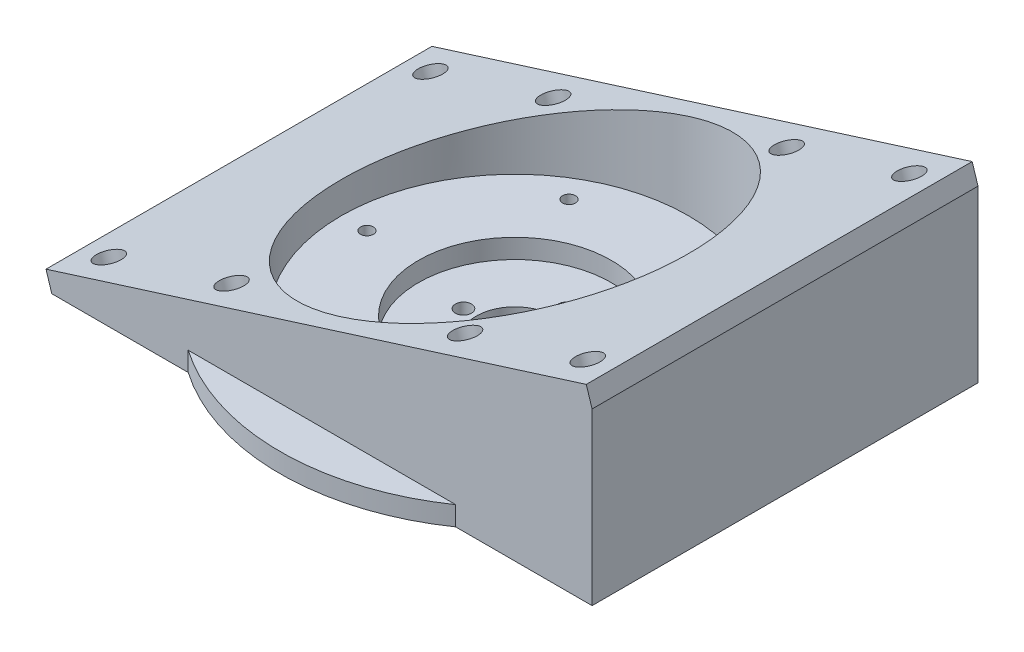
from build123d import *

# Parameters (mm, degrees)
EXTRUDE_1_DEPTH          = 60
SKETCH_2_W               = 88.076446511
SKETCH_2_H               = 60
EXTRUDE_2_DEPTH          = 3
SKETCH_3_R               = 27
CUT_EXTRUDE_1_DEPTH      = 50
SKETCH_4_R               = 36.5
EXTRUDE_3_DEPTH          = 3
SKETCH_13_R              = 20
CUT_EXTRUDE_3_DEPTH      = 60
SKETCH_14_R              = 1
CUT_EXTRUDE_4_DEPTH      = 60
PATTERN_CIRCULAR_1_COUNT = 6
SKETCH_16_R              = 2
CUT_EXTRUDE_5_DEPTH      = 3
PATTERN_LINEAR_1_COUNT   = 2
PATTERN_LINEAR_1_PITCH   = 20
SKETCH_17_R              = 2
CUT_EXTRUDE_6_DEPTH      = 3
PATTERN_LINEAR_2_COUNT   = 2
PATTERN_LINEAR_2_PITCH   = 20
SKETCH_18_R              = 20
EXTRUDE_4_DEPTH          = 6
SKETCH_19_R              = 6
CUT_EXTRUDE_7_DEPTH      = 6
SKETCH_20_R              = 15
CUT_EXTRUDE_8_DEPTH      = 3
SKETCH_21_R              = 1.25
CUT_EXTRUDE_9_DEPTH      = 3
PATTERN_CIRCULAR_2_COUNT = 4


with BuildPart() as part:
    # 草图1 → 凸台-拉伸1 (new body)
    with BuildSketch(Plane.XY):
        Polygon((-67.082379863, -7.957665904), (16.917620137, -7.957665904), (16.917620137, 18.527432362), align=None)
    extrude(amount=EXTRUDE_1_DEPTH)

    # 草图2 → 凸台-拉伸2 (add)
    with BuildSketch(Plane(origin=(-3.783690806, 12.000334093, 0), x_dir=(0.9537169507482267, 0.30070579950427384, 0), z_dir=(-0.30070579950427384, 0.9537169507482267, 0))):
        with Locations((-22.332295804, -30)):
            Rectangle(SKETCH_2_W, SKETCH_2_H)
    extrude(amount=EXTRUDE_2_DEPTH)

    # 草图3 → 切除-拉伸1 (cut)
    with BuildSketch(Plane(origin=(0, -7.957665904, 0), x_dir=(-1, 0, 0), z_dir=(0, -1, 0))):
        with Locations(Location((25.082379863, -30, 0), (0, 0, 90))):
            Circle(SKETCH_3_R)
    extrude(amount=-CUT_EXTRUDE_1_DEPTH, mode=Mode.SUBTRACT)

    # 草图4 → 凸台-拉伸3 (add)
    with BuildSketch(Plane(origin=(0, -7.957665904, 0), x_dir=(-1, 0, 0), z_dir=(0, -1, 0))):
        with Locations((25.082379863, -30)):
            Circle(SKETCH_4_R)
    extrude(amount=-EXTRUDE_3_DEPTH)

    # 草图13 → 切除-拉伸3 (cut)
    with BuildSketch(Plane(origin=(0, -4.957665904, 0), x_dir=(1, 0, 0), z_dir=(0, 1, 0))):
        with Locations(Location((-25.082379863, -30, 0), (0, 0, 270))):
            Circle(SKETCH_13_R)
    extrude(amount=-CUT_EXTRUDE_3_DEPTH, mode=Mode.SUBTRACT)

    # 草图14 → 切除-拉伸4 (cut)
    with BuildSketch(Plane(origin=(0, -4.957665904, 0), x_dir=(1, 0, 0), z_dir=(0, 1, 0))):
        with Locations(Location((-48.082379863, -30, 0), (0, 0, 270))):
            Circle(SKETCH_14_R)
    cut_extrude_4 = extrude(amount=-CUT_EXTRUDE_4_DEPTH, mode=Mode.SUBTRACT)

    # 阵列(圆周)1: 切除-拉伸4 ×6 about axis
    pattern_circular_1_axis = Axis((-25.082379863, 0, 30), (0, 1, 0))
    for i in range(1, PATTERN_CIRCULAR_1_COUNT):
        add(cut_extrude_4.rotate(pattern_circular_1_axis, i * 360 / PATTERN_CIRCULAR_1_COUNT), mode=Mode.SUBTRACT)

    # 草图16 → 切除-拉伸5 (cut)
    with BuildSketch(Plane(origin=(-4.685808204, 14.861484946, 0), x_dir=(0.9537169507482267, 0.3007057995042738, 0), z_dir=(-0.3007057995042738, 0.9537169507482267, 0))):
        with Locations(Location((-61.370519059, -5, 0), (0, 0, 180))):
            Circle(SKETCH_16_R)
        with Locations(Location((-61.370519059, -55, 0), (0, 0, 180))):
            Circle(SKETCH_16_R)
    cut_extrude_5 = extrude(amount=-CUT_EXTRUDE_5_DEPTH, mode=Mode.SUBTRACT)

    # 阵列(线性)1: 切除-拉伸5 ×2
    with Locations(*[Vector(0.9537169507482268, 0.30070579950427384, 0) * (i * PATTERN_LINEAR_1_PITCH) for i in range(1, PATTERN_LINEAR_1_COUNT)]):
        add(cut_extrude_5, mode=Mode.SUBTRACT)

    # 草图17 → 切除-拉伸6 (cut)
    with BuildSketch(Plane(origin=(-4.685808204, 14.861484946, 0), x_dir=(0.9537169507482267, 0.3007057995042738, 0), z_dir=(-0.3007057995042738, 0.9537169507482267, 0))):
        with Locations(Location((16.705927452, -55, 0), (0, 0, 180))):
            Circle(SKETCH_17_R)
        with Locations(Location((16.705927452, -5, 0), (0, 0, 180))):
            Circle(SKETCH_17_R)
    cut_extrude_6 = extrude(amount=-CUT_EXTRUDE_6_DEPTH, mode=Mode.SUBTRACT)

    # 阵列(线性)2: 切除-拉伸6 ×2
    with Locations(*[Vector(-0.9537169507482268, -0.30070579950427384, 0) * (i * PATTERN_LINEAR_2_PITCH) for i in range(1, PATTERN_LINEAR_2_COUNT)]):
        add(cut_extrude_6, mode=Mode.SUBTRACT)

    # 草图18 → 凸台-拉伸4 (add)
    with BuildSketch(Plane(origin=(0, -4.957665904, 0), x_dir=(1, 0, 0), z_dir=(0, 1, 0))):
        with Locations(Location((-25.082379863, -30, 0), (0, 0, 270))):
            Circle(SKETCH_18_R)
    extrude(amount=-EXTRUDE_4_DEPTH)

    # 草图19 → 切除-拉伸7 (cut)
    with BuildSketch(Plane(origin=(0, -4.957665904, 0), x_dir=(1, 0, 0), z_dir=(0, 1, 0))):
        with Locations(Location((-25.082379863, -30, 0), (0, 0, 270))):
            Circle(SKETCH_19_R)
    extrude(amount=-CUT_EXTRUDE_7_DEPTH, mode=Mode.SUBTRACT)

    # 草图20 → 切除-拉伸8 (cut)
    with BuildSketch(Plane(origin=(0, -4.957665904, 0), x_dir=(1, 0, 0), z_dir=(0, 1, 0))):
        with Locations(Location((-25.082379863, -30, 0), (0, 0, 270))):
            Circle(SKETCH_20_R)
    extrude(amount=-CUT_EXTRUDE_8_DEPTH, mode=Mode.SUBTRACT)

    # 草图21 → 切除-拉伸9 (cut)
    with BuildSketch(Plane(origin=(0, -7.957665904, 0), x_dir=(1, 0, 0), z_dir=(0, 1, 0))):
        with Locations(Location((-33.082379863, -30, 0), (0, 0, 270))):
            Circle(SKETCH_21_R)
    cut_extrude_9 = extrude(amount=-CUT_EXTRUDE_9_DEPTH, mode=Mode.SUBTRACT)

    # 阵列(圆周)2: 切除-拉伸9 ×4 about axis
    pattern_circular_2_axis = Axis((-25.082379863, 0, 30), (0, 1, 0))
    for i in range(1, PATTERN_CIRCULAR_2_COUNT):
        add(cut_extrude_9.rotate(pattern_circular_2_axis, i * 360 / PATTERN_CIRCULAR_2_COUNT), mode=Mode.SUBTRACT)


solid = part.part
